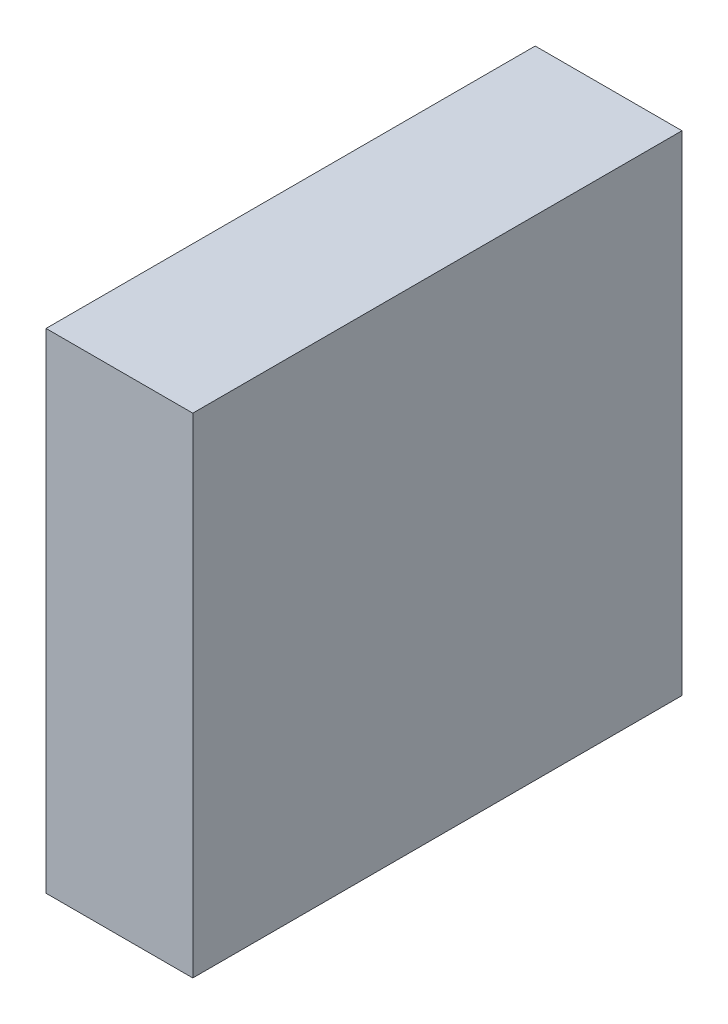
from build123d import *

# Parameters (mm, degrees)
ESBO_O1_W                = 500
ESBO_O1_H                = 500
RESSALTO_EXTRUS_O1_DEPTH = 150


with BuildPart() as part:
    # Esboço1 → Ressalto-extrusão1 (new body)
    with BuildSketch(Plane(origin=(0, 0, 0), x_dir=(0, 0, -1), z_dir=(1, 0, 0))):
        with Locations((-250, 250)):
            Rectangle(ESBO_O1_W, ESBO_O1_H)
    extrude(amount=RESSALTO_EXTRUS_O1_DEPTH)


solid = part.part
